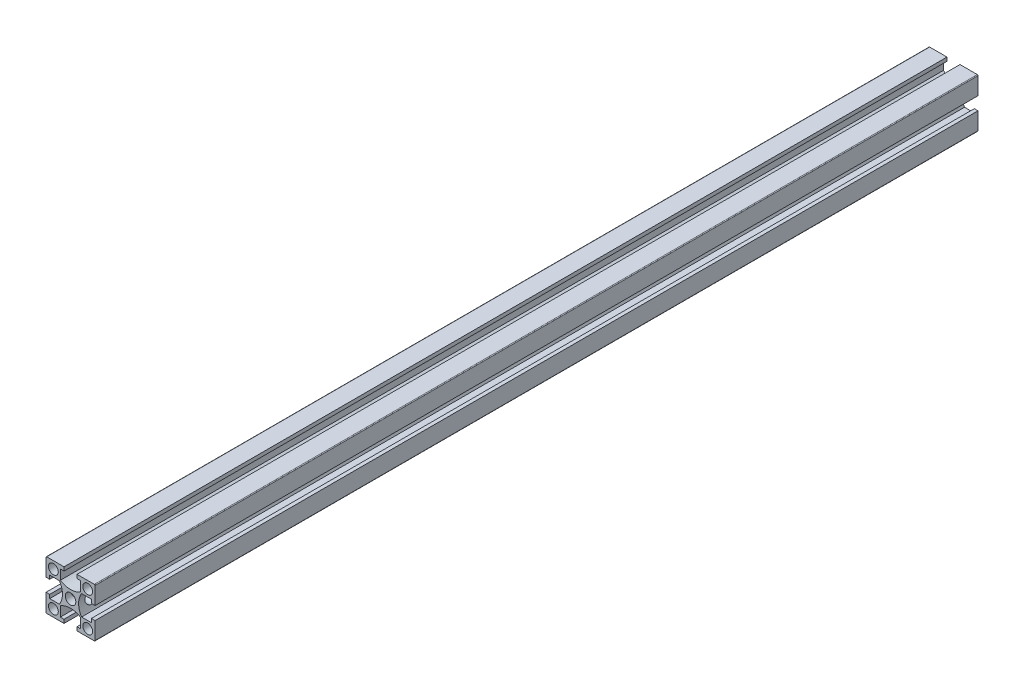
from build123d import *

# Parameters (mm, degrees)
SKETCH_1_W               = 20
SKETCH_1_H               = 20
SKETCH_1_R               = 2
SKETCH_1_R_2             = 2.15
EXTRUDE_1_DEPTH          = 360
CUT_EXTRUDE_1_REACH      = 362.278
PATTERN_CIRCULAR_1_COUNT = 4
FILLET_1_R               = 0.3
CUT_EXTRUDE_2_DEPTH      = 361.277670693
CUT_EXTRUDE_2_DEPTH_BACK = 361.277670693
SKETCH_2_R               = 2.5
SKETCH_4_R               = 2.5
CUT_EXTRUDE_4_DEPTH      = 361.693776037
SKETCH_5_R               = 2.5
CUT_EXTRUDE_5_DEPTH      = 361.693776037


with BuildPart() as part:
    # 스케치1 → 보스-돌출1 (new body)
    with BuildSketch(Plane.XY):
        Rectangle(SKETCH_1_W, SKETCH_1_H)
        with Locations((-7, -7)):
            Circle(SKETCH_1_R, mode=Mode.SUBTRACT)
        with Locations((7, -7)):
            Circle(SKETCH_1_R, mode=Mode.SUBTRACT)
        with Locations((-7, 7)):
            Circle(SKETCH_1_R, mode=Mode.SUBTRACT)
        Circle(SKETCH_1_R_2, mode=Mode.SUBTRACT)
        with Locations((7, 7)):
            Circle(SKETCH_1_R, mode=Mode.SUBTRACT)
    extrude(amount=EXTRUDE_1_DEPTH)

    # 스케치1<3> → 컷-돌출1 (cut, up to next)
    with BuildSketch(Plane.XY, mode=Mode.PRIVATE) as cut_extrude_1_sk1:
        with BuildLine():
            Line((-8.5, 2.65), (-10, 2.65))
            Line((-10, 2.65), (-10, -2.65))
            Line((-10, -2.65), (-8.5, -2.65))
            Line((-8.5, -2.65), (-8.5, -4.15))
            Line((-8.5, -4.15), (-4.503166667, -4.15))
            ThreePointArc((-4.503166667, -4.15), (-3.3, 0), (-4.503166667, 4.15))
            Line((-4.503166667, 4.15), (-8.5, 4.15))
            Line((-8.5, 4.15), (-8.5, 2.65))
        make_face()
    cut_extrude_1_tool1 = extrude(cut_extrude_1_sk1.sketch, amount=CUT_EXTRUDE_1_REACH, mode=Mode.PRIVATE) & part.part
    cut_extrude_1 = cut_extrude_1_tool1.solids().sort_by_distance((-6.606913, 0, 0))[0]
    add(cut_extrude_1, mode=Mode.SUBTRACT)

    # 원형 패턴1: 컷-돌출1 ×4 about axis
    pattern_circular_1_axis = Axis((0, 0, 360), (0, 0, -1))
    for i in range(1, PATTERN_CIRCULAR_1_COUNT):
        add(cut_extrude_1.rotate(pattern_circular_1_axis, i * 360 / PATTERN_CIRCULAR_1_COUNT), mode=Mode.SUBTRACT)

    # 필렛1
    fillet_1_edges = [part.edges().sort_by_distance(p)[0] for p in [
        (10, -10, 180),
        (-10, -10, 180),
        (-10, 10, 180),
        (10, 10, 180),
    ]]
    fillet(fillet_1_edges, radius=FILLET_1_R)

    # 스케치2 → 컷-돌출2 (cut, two sides: drawn at the far end of the back side and taken through both)
    with BuildSketch(Plane(origin=(0, 0, 0), x_dir=(0, 0, -1), z_dir=(1, 0, 0)).offset(-CUT_EXTRUDE_2_DEPTH_BACK)):
        with Locations((-5, 0)):
            Circle(SKETCH_2_R)
        with Locations((-355, 0)):
            Circle(SKETCH_2_R)
    extrude(amount=CUT_EXTRUDE_2_DEPTH + CUT_EXTRUDE_2_DEPTH_BACK, mode=Mode.SUBTRACT)

    # 스케치4 → 컷-돌출4 (cut, through all)
    with BuildSketch(Plane(origin=(10, 0, 0), x_dir=(0, 0, -1), z_dir=(1, 0, 0))):
        with Locations((-295.35, 0)):
            Circle(SKETCH_4_R)
        with Locations((-204.38, 0)):
            Circle(SKETCH_4_R)
        with Locations((-162.38, 0)):
            Circle(SKETCH_4_R)
        with Locations((-44.9, 0)):
            Circle(SKETCH_4_R)
    extrude(amount=-CUT_EXTRUDE_4_DEPTH, mode=Mode.SUBTRACT)

    # 스케치5 → 컷-돌출5 (cut, through all)
    with BuildSketch(Plane.XZ.offset(10)):
        with Locations((0, 349)):
            Circle(SKETCH_5_R)
    extrude(amount=-CUT_EXTRUDE_5_DEPTH, mode=Mode.SUBTRACT)


solid = part.part
